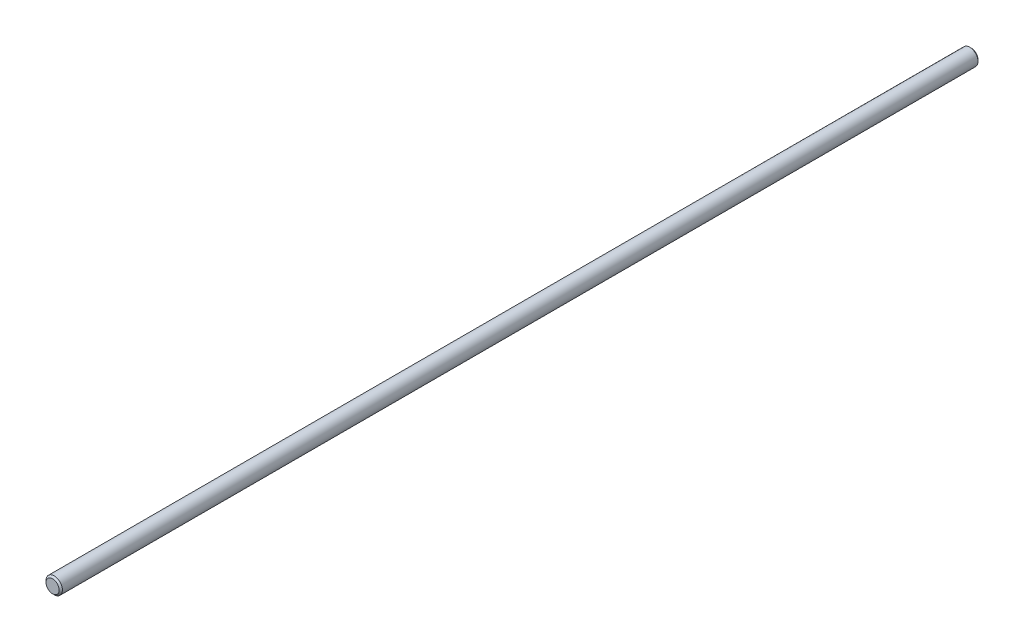
from build123d import *

# Parameters (mm, degrees)
SKETCH_1_R      = 2.5
EXTRUDE_1_DEPTH = 140
CHAMFER_1_SIZE  = 0.5


with BuildPart() as part:
    # 草图1 → 凸台-拉伸1 (new, symmetric)
    with BuildSketch(Plane.XY):
        Circle(SKETCH_1_R)
    extrude(amount=EXTRUDE_1_DEPTH, both=True)

    # 倒角1
    chamfer_1_edges = [part.edges().sort_by_distance(p)[0] for p in [
        (-2.5, 0, -140),
        (-2.5, 0, 140),
    ]]
    chamfer(chamfer_1_edges, length=CHAMFER_1_SIZE)


solid = part.part
